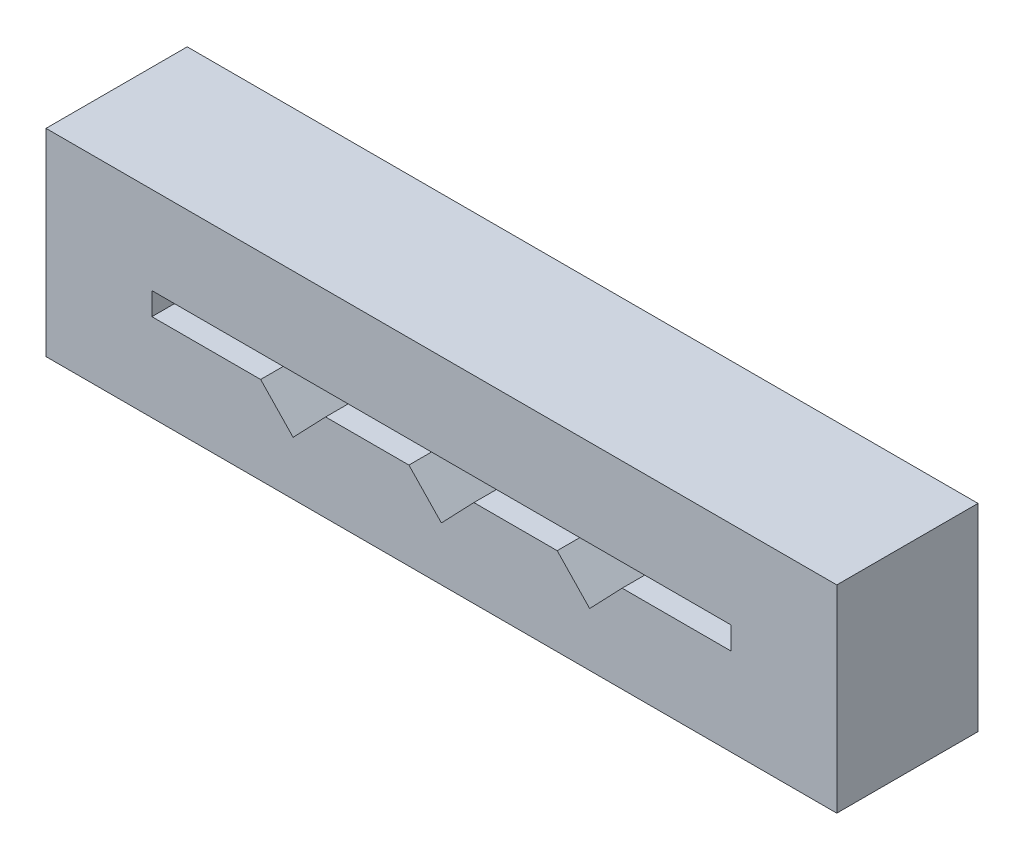
from build123d import *

# Parameters (mm, degrees)
SKETCH_1_W          = 28
SKETCH_1_H          = 7
EXTRUDE_1_DEPTH     = 5
CUT_EXTRUDE_1_DEPTH = 16.272524349
CHAMFER_1_SIZE      = 0.5


with BuildPart() as part:
    # Эскиз1 → Бобышка-Вытянуть1 (new body)
    with BuildSketch(Plane(origin=(0, 66.754264805, 0), x_dir=(-1, 0, 0), z_dir=(0, 0, 1))):
        with Locations((0, 66.754264805)):
            Rectangle(SKETCH_1_W, SKETCH_1_H)
    extrude(amount=EXTRUDE_1_DEPTH)

    # Эскиз4 → Вырез-Вытянуть1 (cut, through all)
    with BuildSketch(Plane(origin=(0, 0, 0), x_dir=(-1, 0, 0), z_dir=(0, 0, -1))):
        Polygon((-10.25, -0.4), (-10.25, 0.4), (10.25, 0.4), (10.25, -0.4), (6.4, -0.4), (5.25, -1.6), (4.1, -0.4), (1.15, -0.4), (0, -1.6), (-1.15, -0.4), (-4.1, -0.4), (-5.25, -1.6), (-6.4, -0.4), align=None)
    extrude(amount=-CUT_EXTRUDE_1_DEPTH, mode=Mode.SUBTRACT)

    # Фаска1
    chamfer_1_edges = [part.edges().sort_by_distance(p)[0] for p in [
        (8.325, -0.4, 0),
        (2.625, -0.4, 0),
        (-2.625, -0.4, 0),
        (-8.325, -0.4, 0),
        (-10.25, 0, 0),
        (0, 0.4, 0),
        (10.25, 0, 0),
    ]]
    chamfer(chamfer_1_edges, length=CHAMFER_1_SIZE)


solid = part.part
